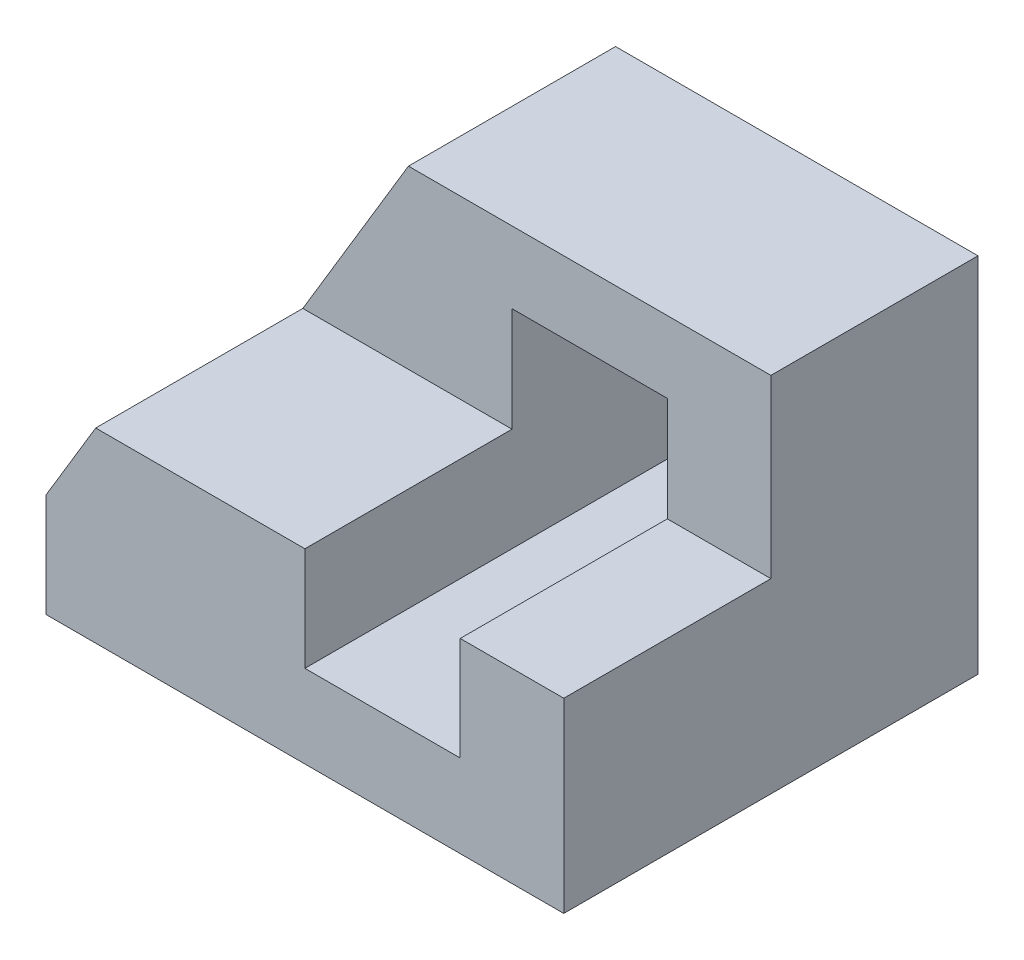
from build123d import *

# Parameters (mm, degrees)
BOSS_EXTRUDE1_DEPTH = 40
BOSS_EXTRUDE2_DEPTH = 20


with BuildPart() as part:
    # Sketch1 → Boss-Extrude1 (new body)
    with BuildSketch(Plane.XY):
        Polygon((0, 10), (0, 0), (50, 0), (50, 18), (40, 18), (40, 8), (25, 8), (25, 18), (4.8, 18), align=None)
    extrude(amount=BOSS_EXTRUDE1_DEPTH)

    # Sketch1<3> → Boss-Extrude2 (add)
    with BuildSketch(Plane.XY):
        Polygon((40, 18), (50, 18), (50, 35), (15, 35), (4.8, 18), (25, 18), (25, 28.078689743), (40, 28.078689743), align=None)
    extrude(amount=BOSS_EXTRUDE2_DEPTH)


solid = part.part
